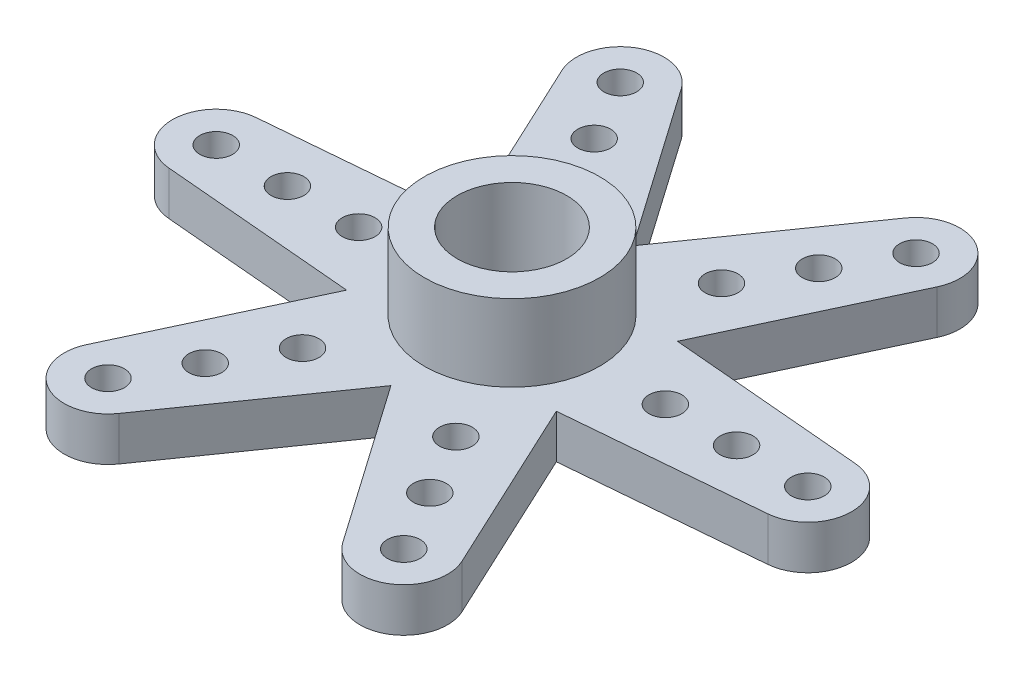
from build123d import *

# Parameters (mm, degrees)
ESBO_O2_R                = 0.75
RESSALTO_EXTRUS_O1_DEPTH = 2
PADR_OCIRCULAR1_COUNT    = 6
ESBO_O3_R                = 4
ESBO_O3_R_2              = 2.5
RESSALTO_EXTRUS_O2_DEPTH = 3.5
CORTE_EXTRUS_O1_START    = -1
ESBO_O4_R                = 2.5
ESBO_O4_R_2              = 0.75
CORTE_EXTRUS_O1_DEPTH    = 1
RESSALTO_EXTRUS_O3_START = 1
ESBO_O5_R                = 3
ESBO_O5_R_2              = 2.5
RESSALTO_EXTRUS_O3_DEPTH = 1


with BuildPart() as part:
    # Esboço2 → Ressalto-extrusão1 (new body)
    with BuildSketch(Plane(origin=(0, 0, 0), x_dir=(1, 0, 0), z_dir=(0, 1, 0))):
        with BuildLine():
            Line((-13.672903959, 1.992512038), (-4.128356106, 2.82075803))
            ThreePointArc((-4.128356106, 2.82075803), (5, 0), (-4.128356106, -2.82075803))
            Line((-4.128356106, -2.82075803), (-13.672903959, -1.992512038))
            ThreePointArc((-13.672903959, -1.992512038), (-15.5, 0), (-13.672903959, 1.992512038))
        make_face()
        with Locations(Location((0, 0, 0), (0, 0, 270))):
            Circle(ESBO_O2_R, mode=Mode.SUBTRACT)
        with Locations(Location((-7, 0, 0), (0, 0, 270))):
            Circle(ESBO_O2_R, mode=Mode.SUBTRACT)
        with Locations(Location((-10.25, 0, 0), (0, 0, 270))):
            Circle(ESBO_O2_R, mode=Mode.SUBTRACT)
        with Locations(Location((-13.5, 0, 0), (0, 0, 270))):
            Circle(ESBO_O2_R, mode=Mode.SUBTRACT)
    ressalto_extrus_o1 = extrude(amount=RESSALTO_EXTRUS_O1_DEPTH)

    # PadrãoCircular1: Ressalto-extrusão1 ×6 about axis
    padr_ocircular1_axis = Axis((0, 0, 0), (0, 1, 0))
    for i in range(1, PADR_OCIRCULAR1_COUNT):
        add(ressalto_extrus_o1.rotate(padr_ocircular1_axis, i * 360 / PADR_OCIRCULAR1_COUNT))

    # Esboço3 → Ressalto-extrusão2 (add)
    with BuildSketch(Plane(origin=(0, 2, 0), x_dir=(1, 0, 0), z_dir=(0, 1, 0))):
        with Locations(Location((0, 0, 0), (0, 0, 270))):
            Circle(ESBO_O3_R)
        with Locations(Location((0, 0, 0), (0, 0, 270))):
            Circle(ESBO_O3_R_2, mode=Mode.SUBTRACT)
    extrude(amount=RESSALTO_EXTRUS_O2_DEPTH)

    # Esboço4 → Corte-extrusão1 (cut)
    with BuildSketch(Plane(origin=(0, 2, 0), x_dir=(1, 0, 0), z_dir=(0, 1, 0)).offset(CORTE_EXTRUS_O1_START)):
        with Locations(Location((0, 0, 0), (0, 0, 270))):
            Circle(ESBO_O4_R)
        with Locations(Location((0, 0, 0), (0, 0, 270))):
            Circle(ESBO_O4_R_2, mode=Mode.SUBTRACT)
    extrude(amount=CORTE_EXTRUS_O1_DEPTH, mode=Mode.SUBTRACT)

    # Esboço5 → Ressalto-extrusão3 (add)
    with BuildSketch(Plane.XZ.offset(RESSALTO_EXTRUS_O3_START)):
        with Locations(Location((0, 0, 0), (0, 0, 90))):
            Circle(ESBO_O5_R)
        with Locations(Location((0, 0, 0), (0, 0, 90))):
            Circle(ESBO_O5_R_2, mode=Mode.SUBTRACT)
    extrude(amount=-RESSALTO_EXTRUS_O3_DEPTH)


solid = part.part
